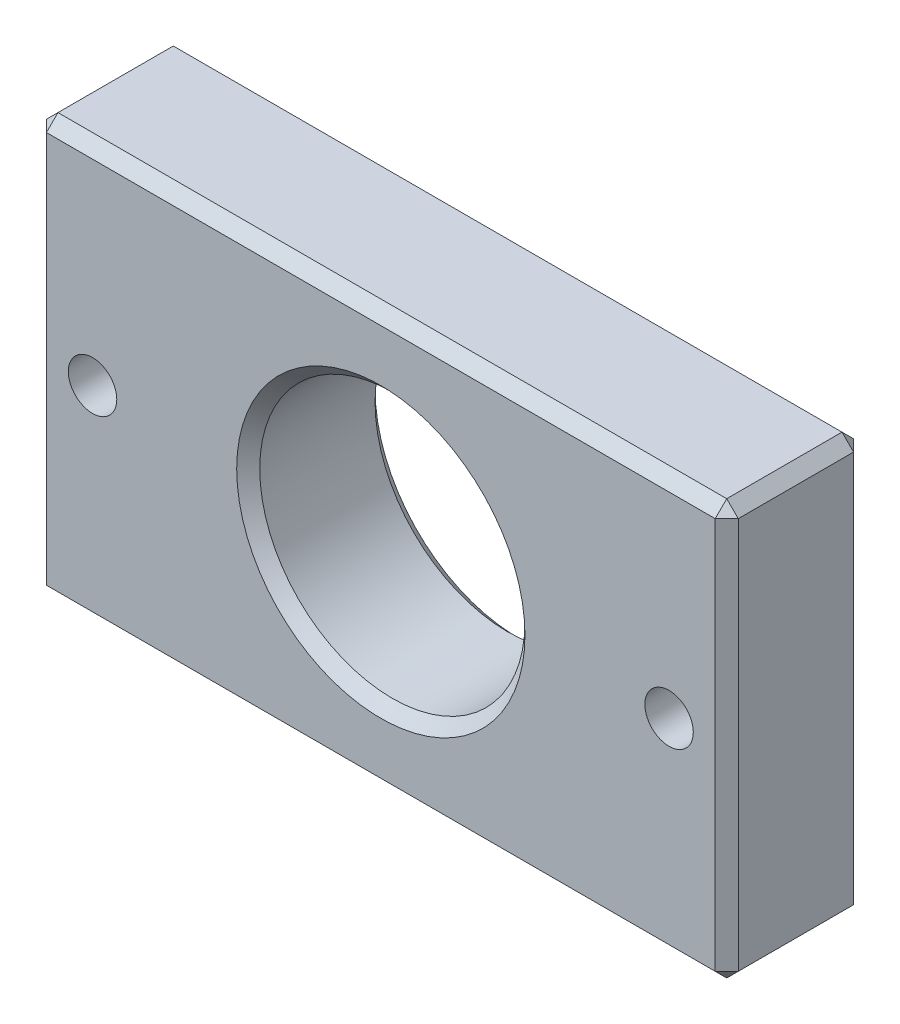
from build123d import *

# Parameters (mm, degrees)
ESQUISSE1_W             = 60
ESQUISSE1_H             = 36
BOSS_EXTRU_1_DEPTH      = 12
ENL_V_MAT_EXTRU_1_REACH = 38.986
ESQUISSE2_R             = 11.5
TROU_TARAUD_M51_D       = 4.2
CHANFREIN1_SIZE         = 1


with BuildPart() as part:
    # Esquisse1 → Boss.-Extru.1 (new body)
    with BuildSketch(Plane.XY):
        Rectangle(ESQUISSE1_W, ESQUISSE1_H)
    extrude(amount=BOSS_EXTRU_1_DEPTH)

    # Esquisse2 → Enlèv. mat.-Extru.1 (cut, up to next)
    with BuildSketch(Plane.XY.offset(12), mode=Mode.PRIVATE) as enl_v_mat_extru_1_sk1:
        Circle(ESQUISSE2_R)
    enl_v_mat_extru_1_tool1 = extrude(enl_v_mat_extru_1_sk1.sketch, amount=-ENL_V_MAT_EXTRU_1_REACH, mode=Mode.PRIVATE) & part.part
    add(enl_v_mat_extru_1_tool1.solids().sort_by_distance((0, 0, 12))[0], mode=Mode.SUBTRACT)

    # Trou taraudé M51 (through all)
    with Locations(Plane.XY.offset(12)):
        with Locations((-25, 0), (25, 0)):
            Hole(TROU_TARAUD_M51_D / 2)

    # Chanfrein1
    chanfrein1_edges = [part.edges().sort_by_distance(p)[0] for p in [
        (30, 0, 12),
        (0, 18, 12),
        (-11.5, 0, 12),
        (-11.5, 0, 0),
        (-30, 0, 12),
        (0, 18, 0),
        (30, 0, 0),
        (0, -18, 0),
        (-30, 0, 0),
        (0, -18, 12),
        (-30, 18, 6),
        (30, 18, 6),
        (30, -18, 6),
        (-30, -18, 6),
    ]]
    chamfer(chanfrein1_edges, length=CHANFREIN1_SIZE)


solid = part.part
